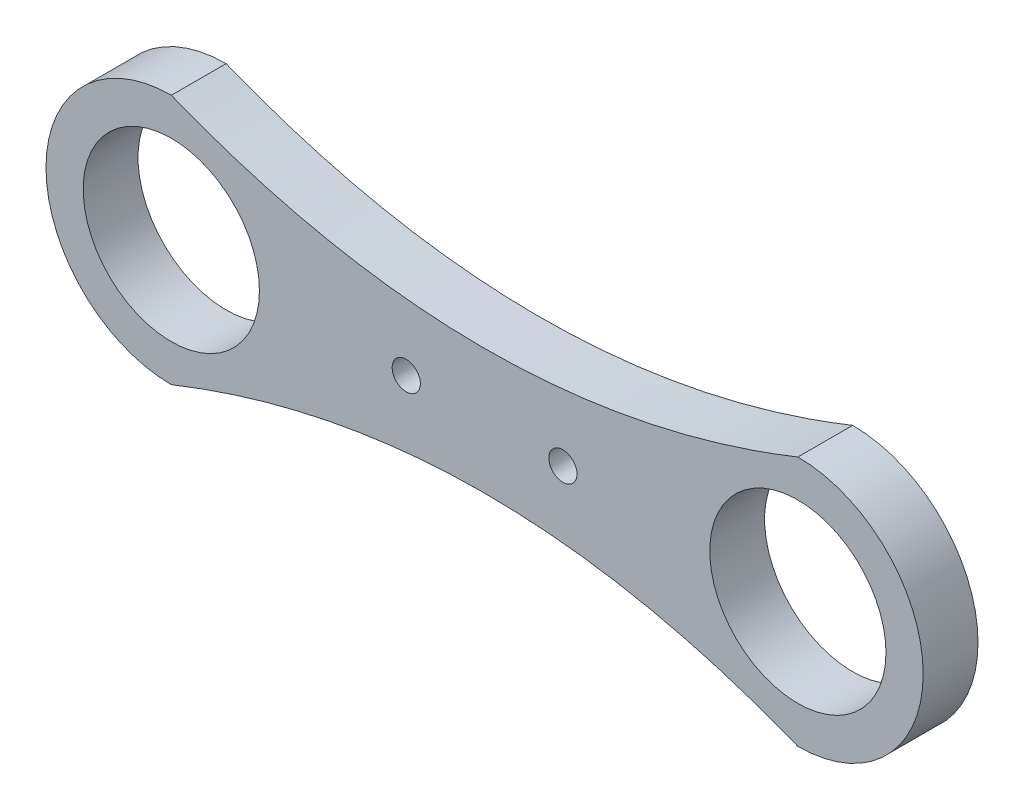
from build123d import *

# Parameters (mm, degrees)
ESQUISSE1_R             = 11.25
BOSS_EXTRU_1_DEPTH      = 7
ESQUISSE2_R             = 1.8
ENL_V_MAT_EXTRU_1_DEPTH = 10


with BuildPart() as part:
    # Esquisse1 → Boss.-Extru.1 (new body)
    with BuildSketch(Plane.XY):
        with BuildLine():
            ThreePointArc((0, 16), (-16, 0), (0, -16))
            add(Edge.make_bspline(
                [(0, -16), (40, 0), (80, -16)],
                knots=[0, 0, 0, 1, 1, 1], degree=2))
            ThreePointArc((80, -16), (96, 0), (80, 16))
            add(Edge.make_bspline(
                [(0, 16), (40, 0), (80, 16)],
                knots=[0, 0, 0, 1, 1, 1], degree=2))
        make_face()
        with Locations((80, 0)):
            Circle(ESQUISSE1_R, mode=Mode.SUBTRACT)
        Circle(ESQUISSE1_R, mode=Mode.SUBTRACT)
    extrude(amount=BOSS_EXTRU_1_DEPTH)

    # Esquisse2 → Enlèv. mat.-Extru.1 (cut)
    with BuildSketch(Plane.XY.offset(7)):
        with Locations((30, 0)):
            Circle(ESQUISSE2_R)
        with Locations((50, 0)):
            Circle(ESQUISSE2_R)
    extrude(amount=-ENL_V_MAT_EXTRU_1_DEPTH, mode=Mode.SUBTRACT)


solid = part.part
